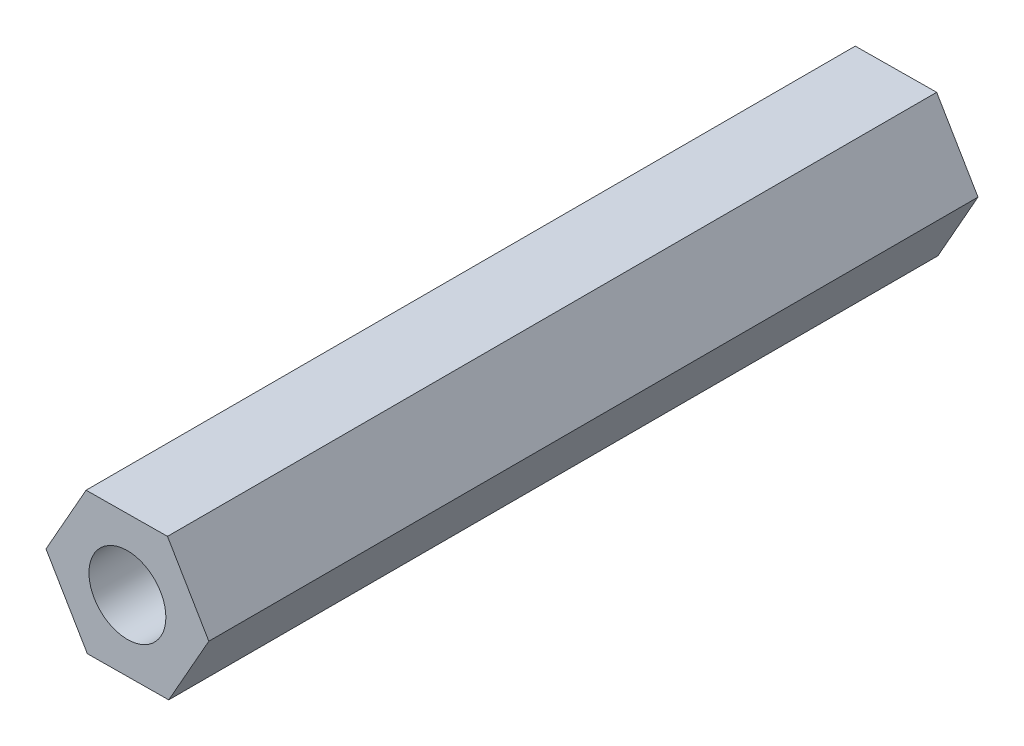
from build123d import *

# Parameters (mm, degrees)
SKETCH_1_R      = 1.5
EXTRUDE_1_DEPTH = 30


with BuildPart() as part:
    # 草图1 → 凸台-拉伸1 (new body)
    with BuildSketch(Plane.XY):
        Polygon((1.61185848, -2.735917684), (3.175303457, 0.027951549), (1.563444977, 2.763869233), (-1.61185848, 2.735917684), (-3.175303457, -0.027951549), (-1.563444977, -2.763869233), align=None)
        Circle(SKETCH_1_R, mode=Mode.SUBTRACT)
    extrude(amount=EXTRUDE_1_DEPTH)


solid = part.part
